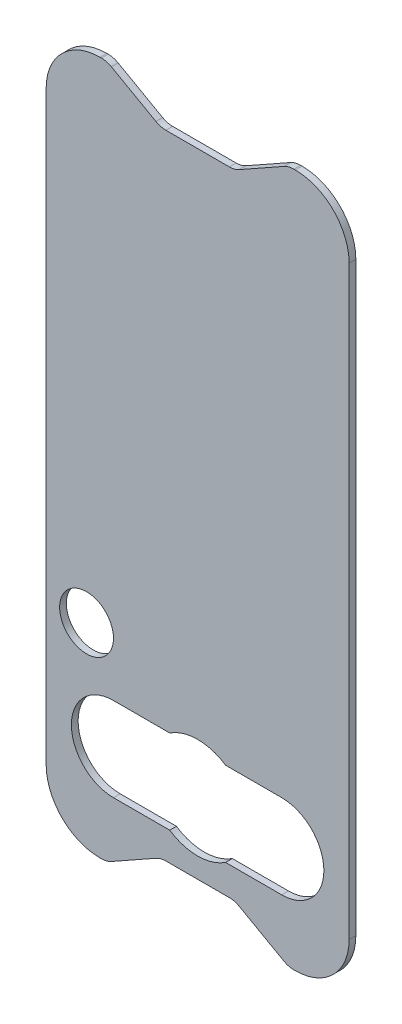
from build123d import *

# Parameters (mm, degrees)
SKETCH1_W           = 45
SKETCH1_H           = 103
BOSS_EXTRUDE1_DEPTH = 1
FILLET1_R           = 8
SKETCH2_R           = 4
CUT_EXTRUDE1_DEPTH  = 1
CUT_EXTRUDE2_DEPTH  = 1
BOSS_EXTRUDE2_DEPTH = 1
SKETCH5_R           = 7.5
CUT_EXTRUDE3_DEPTH  = 10
FILLET2_R           = 3


with BuildPart() as part:
    # Sketch1 → Boss-Extrude1 (new body)
    with BuildSketch(Plane.XY):
        with Locations((22.5, 51.5)):
            Rectangle(SKETCH1_W, SKETCH1_H)
        with BuildLine():
            Line((10.75, 22.25), (34.25, 22.25))
            ThreePointArc((34.25, 22.25), (41.5, 15), (34.25, 7.75))
            Line((34.25, 7.75), (10.75, 7.75))
            ThreePointArc((10.75, 7.75), (3.5, 15), (10.75, 22.25))
        make_face(mode=Mode.SUBTRACT)
    extrude(amount=BOSS_EXTRUDE1_DEPTH)

    # Fillet1
    fillet1_edges = [part.edges().sort_by_distance(p)[0] for p in [
        (0, 103, 0.5),
        (45, 103, 0.5),
        (45, 0, 0.5),
        (0, 0, 0.5),
    ]]
    fillet(fillet1_edges, radius=FILLET1_R)

    # Sketch2 → Cut-Extrude1 (cut)
    with BuildSketch(Plane.XY.offset(1)):
        with Locations((6, 29.25)):
            Circle(SKETCH2_R)
    extrude(amount=-CUT_EXTRUDE1_DEPTH, mode=Mode.SUBTRACT)

    # Sketch3 → Cut-Extrude2 (cut)
    with BuildSketch(Plane.XY.offset(1)):
        Polygon((17, 98.5), (28, 98.5), (36, 103), (9, 103), align=None)
        Polygon((17, 4.5), (28, 4.5), (36, 0), (9, 0), align=None)
    extrude(amount=-CUT_EXTRUDE2_DEPTH, mode=Mode.SUBTRACT)

    # Sketch4 → Boss-Extrude2 (add)
    with BuildSketch(Plane.XY.offset(1)):
        with BuildLine():
            Line((9.607201991, 23.81242846), (35.392798009, 23.81242846))
            ThreePointArc((35.392798009, 23.81242846), (44.205226468, 15), (35.392798009, 6.18757154))
            Line((35.392798009, 6.18757154), (9.607201991, 6.18757154))
            ThreePointArc((9.607201991, 6.18757154), (0.794773532, 15), (9.607201991, 23.81242846))
        make_face()
        with BuildLine():
            Line((10, 21.25), (18.354219012, 21.25))
            ThreePointArc((18.354219012, 21.25), (22.5, 22.5), (26.645780988, 21.25))
            Line((26.645780988, 21.25), (35, 21.25))
            ThreePointArc((35, 21.25), (41.25, 15), (35, 8.75))
            Line((35, 8.75), (26.645780988, 8.75))
            ThreePointArc((26.645780988, 8.75), (22.5, 7.5), (18.354219012, 8.75))
            Line((18.354219012, 8.75), (10, 8.75))
            ThreePointArc((10, 8.75), (3.75, 15), (10, 21.25))
        make_face(mode=Mode.SUBTRACT)
    extrude(amount=-BOSS_EXTRUDE2_DEPTH)

    # Sketch5 → Cut-Extrude3 (cut)
    with BuildSketch(Plane.XY.offset(1)):
        with Locations((22.5, 15)):
            Circle(SKETCH5_R)
    extrude(amount=-CUT_EXTRUDE3_DEPTH, mode=Mode.SUBTRACT)

    # Fillet2
    fillet2_edges = [part.edges().sort_by_distance(p)[0] for p in [
        (36, 103, 0.5),
        (28, 98.5, 0.5),
        (17, 98.5, 0.5),
        (9, 103, 0.5),
        (28, 4.5, 0.5),
        (36, 0, 0.5),
        (9, 0, 0.5),
        (17, 4.5, 0.5),
    ]]
    fillet(fillet2_edges, radius=FILLET2_R)


solid = part.part
